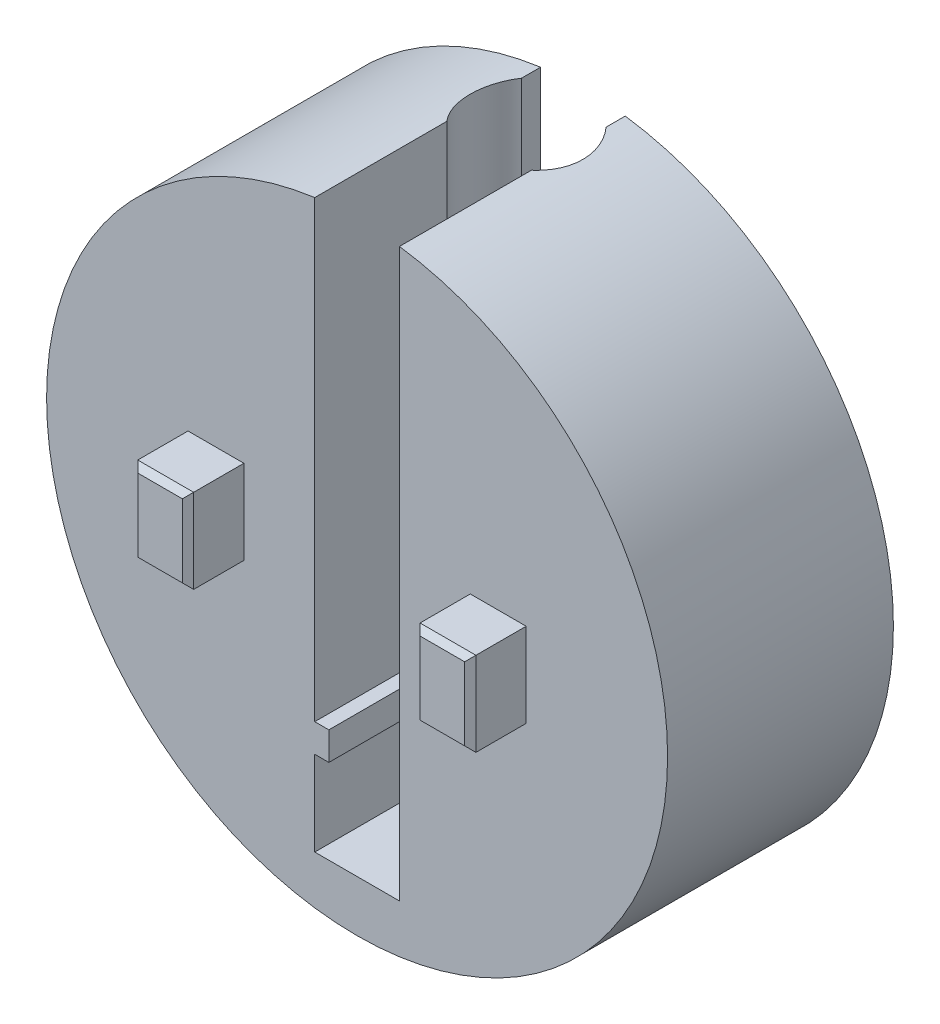
from build123d import *

# Parameters (mm, degrees)
BOSS_EXTRUDE1_DEPTH             = 8
SKETCH8_R                       = 2
PIN_HOLE_DEPTH                  = 5.183346
PIN_HOLE_DIRECTION_2_REACH      = 19.493
PIN_HOLE_DIRECTION_2_END_RADIUS = 11
SKETCH6_W                       = 2
SKETCH6_H                       = 3
CUT_EXTRUDE2_DEPTH              = 2
SKETCH7_W                       = 1.98
SKETCH7_H                       = 2.98
BOSS_EXTRUDE4_DEPTH             = 1.98
CHAMFER1_SIZE                   = 0.2


with BuildPart() as part:
    # Sketch1 → Boss-Extrude1 (new body)
    with BuildSketch(Plane.XY):
        with BuildLine():
            ThreePointArc((-1.5, 10.897247359), (0, -11), (1.5, 10.897247359))
            Line((1.5, 10.897247359), (1.5, -9.183346174))
            Line((1.5, -9.183346174), (-1.5, -9.183346174))
            Line((-1.5, -9.183346174), (-1.5, -6.183346174))
            Line((-1.5, -6.183346174), (-1, -6.183346174))
            Line((-1, -6.183346174), (-1, -5.183346174))
            Line((-1, -5.183346174), (-1.5, -5.183346174))
            Line((-1.5, -5.183346174), (-1.5, 10.897247359))
        make_face()
    extrude(amount=BOSS_EXTRUDE1_DEPTH)

    # Sketch8 → pin hole (cut)
    with BuildSketch(Plane(origin=(0, 0, 0), x_dir=(1, 0, 0), z_dir=(0, 1, 0))):
        with Locations((0, -2)):
            Circle(SKETCH8_R)
    extrude(amount=-PIN_HOLE_DEPTH, mode=Mode.SUBTRACT)

    # pin hole direction 2: up to this cylinder (the profile starts inside it)
    pin_hole_direction_2_end = Plane(origin=(0, 0, 2), z_dir=(0, 0, -1)) * Cylinder(PIN_HOLE_DIRECTION_2_END_RADIUS, 61.986, mode=Mode.PRIVATE)
    # Sketch8 → pin hole direction 2 (cut, up to the surface)
    with BuildSketch(Plane(origin=(0, 0, 0), x_dir=(1, 0, 0), z_dir=(0, 1, 0)), mode=Mode.PRIVATE) as pin_hole_direction_2_sk1:
        with Locations((0, -2)):
            Circle(SKETCH8_R)
    pin_hole_direction_2_tool1 = extrude(pin_hole_direction_2_sk1.sketch, amount=PIN_HOLE_DIRECTION_2_REACH, mode=Mode.PRIVATE) & pin_hole_direction_2_end
    add(pin_hole_direction_2_tool1.solids().sort_by_distance((0, 0, 2))[0], mode=Mode.SUBTRACT)

    # Sketch6 → Cut-Extrude2 (cut)
    with BuildSketch(Plane(origin=(0, 0, 0), x_dir=(-1, 0, 0), z_dir=(0, 0, -1))):
        with Locations((-5, 0)):
            Rectangle(SKETCH6_W, SKETCH6_H)
        with Locations((5, 0)):
            Rectangle(SKETCH6_W, SKETCH6_H)
    extrude(amount=-CUT_EXTRUDE2_DEPTH, mode=Mode.SUBTRACT)

    # Sketch7 → Boss-Extrude4 (add)
    with BuildSketch(Plane.XY.offset(8)):
        with Locations((-5, 0)):
            Rectangle(SKETCH7_W, SKETCH7_H)
        with Locations((5, 0)):
            Rectangle(SKETCH7_W, SKETCH7_H)
    extrude(amount=BOSS_EXTRUDE4_DEPTH)

    # Chamfer1
    chamfer1_edges = [part.edges().sort_by_distance(p)[0] for p in [
        (-5.99, 0, 9.98),
        (-5, -1.49, 9.98),
        (-4.01, 0, 9.98),
        (-5, 1.49, 9.98),
        (4.01, 0, 9.98),
        (5, -1.49, 9.98),
        (5.99, 0, 9.98),
        (5, 1.49, 9.98),
    ]]
    chamfer(chamfer1_edges, length=CHAMFER1_SIZE)


solid = part.part
